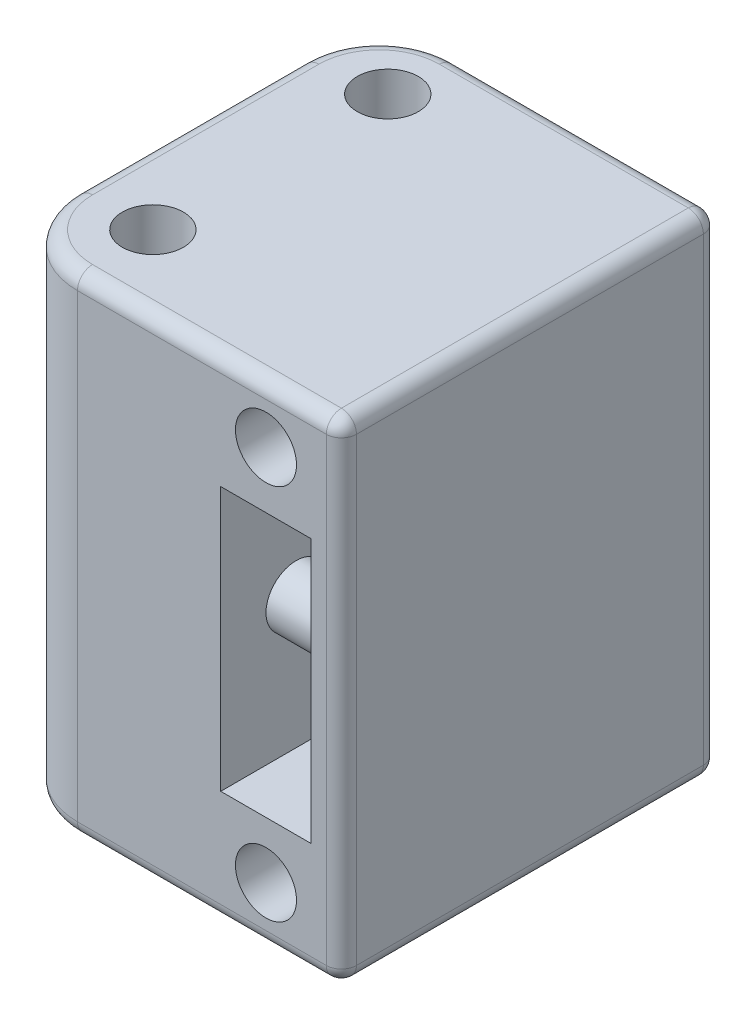
from build123d import *

# Parameters (mm, degrees)
SKETCH1_R               = 10
BOSS_EXTRUDE1_DEPTH     = 65
BOSS_EXTRUDE2_DEPTH     = 10
BOSS_EXTRUDE3_DEPTH     = 65
SKETCH4_R               = 4.05
CUT_EXTRUDE1_DEPTH      = 84.964278119
FILLET1_R               = 10
FILLET2_R               = 2
CUT_EXTRUDE2_DEPTH      = 90.162772501
CUT_EXTRUDE2_DEPTH_BACK = 90.162772501
SKETCH6_R               = 4.05
SKETCH7_W               = 12
SKETCH7_H               = 35
CUT_EXTRUDE3_DEPTH      = 90.162772501
BOSS_EXTRUDE4_REACH     = 88.637
SKETCH8_R               = 4


with BuildPart() as part:
    # Sketch1 → Boss-Extrude1 (new body)
    with BuildSketch(Plane(origin=(0, 0, 0), x_dir=(1, 0, 0), z_dir=(0, 1, 0))):
        with Locations(Location((0, 0, 0), (0, 0, 270))):
            Circle(SKETCH1_R)
    extrude(amount=-BOSS_EXTRUDE1_DEPTH)

    # Sketch2 → Boss-Extrude2 (add)
    with BuildSketch(Plane(origin=(0, 0, 0), x_dir=(1, 0, 0), z_dir=(0, 1, 0))):
        with BuildLine():
            Line((0, -10), (35, -10))
            Line((35, -10), (35, 40))
            Line((35, 40), (-10, 40))
            Line((-10, 40), (-10, 0))
            ThreePointArc((-10, 0), (-7.071067812, -7.071067812), (0, -10))
        make_face()
    extrude(amount=-BOSS_EXTRUDE2_DEPTH)

    # Sketch3 → Boss-Extrude3 (add)
    with BuildSketch(Plane(origin=(0, 0, 0), x_dir=(1, 0, 0), z_dir=(0, 1, 0))):
        with BuildLine():
            Line((35, -10), (35, 40))
            Line((35, 40), (15, 40))
            Line((15, 40), (15, 10))
            Line((15, 10), (0, 10))
            ThreePointArc((0, 10), (-7.071067812, 7.071067812), (-10, 0))
            ThreePointArc((-10, 0), (-7.071067812, -7.071067812), (0, -10))
            Line((0, -10), (35, -10))
        make_face()
    extrude(amount=-BOSS_EXTRUDE3_DEPTH)

    # Sketch4 → Cut-Extrude1 (cut, through all)
    with BuildSketch(Plane(origin=(0, 0, 0), x_dir=(1, 0, 0), z_dir=(0, 1, 0))):
        with Locations(Location((0, 0, 0), (0, 0, 270))):
            Circle(SKETCH4_R)
        with Locations(Location((0, 31.15, 0), (0, 0, 270))):
            Circle(SKETCH4_R)
    extrude(amount=-CUT_EXTRUDE1_DEPTH, mode=Mode.SUBTRACT)

    # Fillet1
    fillet1_edges = [part.edges().sort_by_distance(p)[0] for p in [
        (-10, -5, -40),
    ]]
    fillet(fillet1_edges, radius=FILLET1_R)

    # Fillet2
    fillet2_edges = [part.edges().sort_by_distance(p)[0] for p in [
        (35, -32.5, 10),
        (17.5, 0, 10),
        (35, 0, -15),
        (17.5, 0, -40),
        (-10, -65, 0),
        (7.5, -65, -10),
        (15, -65, -25),
        (25, -65, -40),
        (35, -65, -15),
        (17.5, -65, 10),
        (-7.071067812, 0, 7.071067812),
        (-10, 0, -15),
        (-7.071067812, 0, -37.071067812),
        (35, -32.5, -40),
    ]]
    fillet(fillet2_edges, radius=FILLET2_R)

    # Sketch6 → Cut-Extrude2 (cut, two sides: drawn at the far end of the back side and taken through both)
    with BuildSketch(Plane(origin=(0, 0, -40), x_dir=(-1, 0, 0), z_dir=(0, 0, -1)).offset(-CUT_EXTRUDE2_DEPTH_BACK)):
        with Locations((-24.999085547, -7.5)):
            Circle(SKETCH6_R)
        with Locations((-24.999085547, -57.5)):
            Circle(SKETCH6_R)
    extrude(amount=CUT_EXTRUDE2_DEPTH + CUT_EXTRUDE2_DEPTH_BACK, mode=Mode.SUBTRACT)

    # Sketch7 → Cut-Extrude3 (cut, through all)
    with BuildSketch(Plane(origin=(0, 0, -40), x_dir=(-1, 0, 0), z_dir=(0, 0, -1))):
        with Locations((-25, -32.5)):
            Rectangle(SKETCH7_W, SKETCH7_H)
    extrude(amount=-CUT_EXTRUDE3_DEPTH, mode=Mode.SUBTRACT)

    # Sketch8 → Boss-Extrude4 (add, up to next)
    with BuildSketch(Plane.ZY.offset(-31), mode=Mode.PRIVATE) as boss_extrude4_sk1:
        with Locations(Location((0, -32.5, 0), (0, 0, 90))):
            Circle(SKETCH8_R)
    boss_extrude4_tool1 = extrude(boss_extrude4_sk1.sketch, amount=BOSS_EXTRUDE4_REACH, mode=Mode.PRIVATE) - part.part
    add(boss_extrude4_tool1.solids().sort_by_distance((31, -32.5, 0))[0])


solid = part.part
